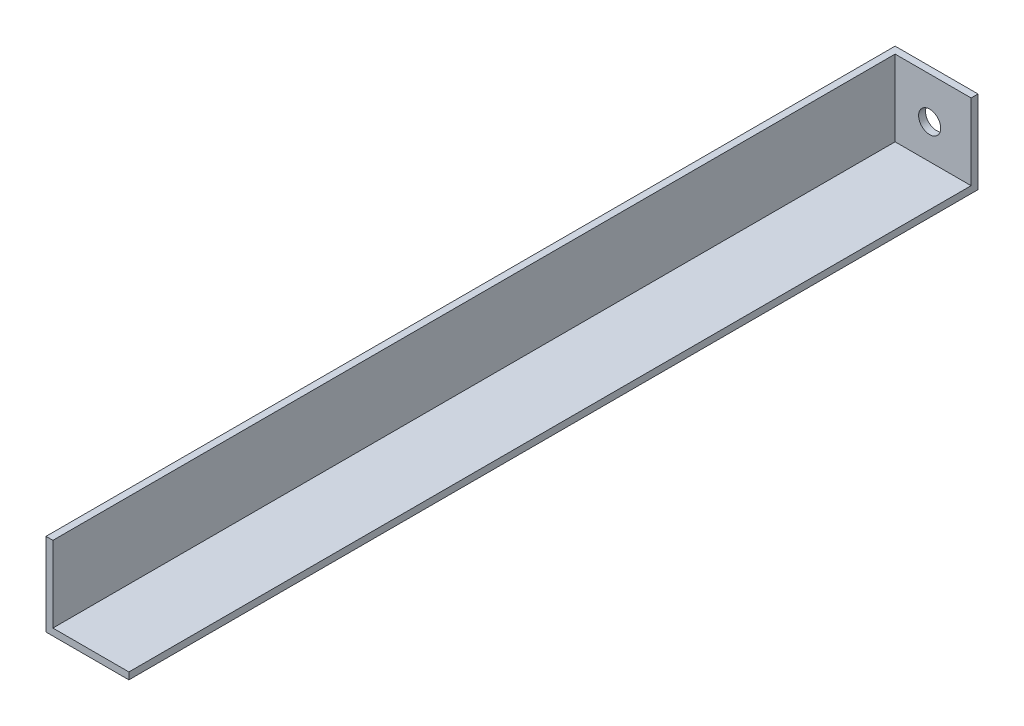
from build123d import *

# Parameters (mm, degrees)
BOSS_EXTRUDE1_DEPTH = 304.8
SKETCH2_W           = 30
SKETCH2_H           = 30
BOSS_EXTRUDE2_DEPTH = 2.5
SKETCH3_R           = 4
CUT_EXTRUDE1_DEPTH  = 311.214909377


with BuildPart() as part:
    # Sketch1 → Boss-Extrude1 (new body)
    with BuildSketch(Plane.XY):
        Polygon((0, 0), (0, 30), (2.5, 30), (2.5, 2.5), (30, 2.5), (30, 0), align=None)
    extrude(amount=BOSS_EXTRUDE1_DEPTH)

    # Sketch2 → Boss-Extrude2 (add)
    with BuildSketch(Plane(origin=(0, 0, 0), x_dir=(-1, 0, 0), z_dir=(0, 0, -1))):
        with Locations((-15, 15)):
            Rectangle(SKETCH2_W, SKETCH2_H)
    extrude(amount=BOSS_EXTRUDE2_DEPTH)

    # Sketch3 → Cut-Extrude1 (cut, through all)
    with BuildSketch(Plane(origin=(0, 0, -2.5), x_dir=(-1, 0, 0), z_dir=(0, 0, -1))):
        with Locations((-15, 15)):
            Circle(SKETCH3_R)
    extrude(amount=-CUT_EXTRUDE1_DEPTH, mode=Mode.SUBTRACT)


solid = part.part
